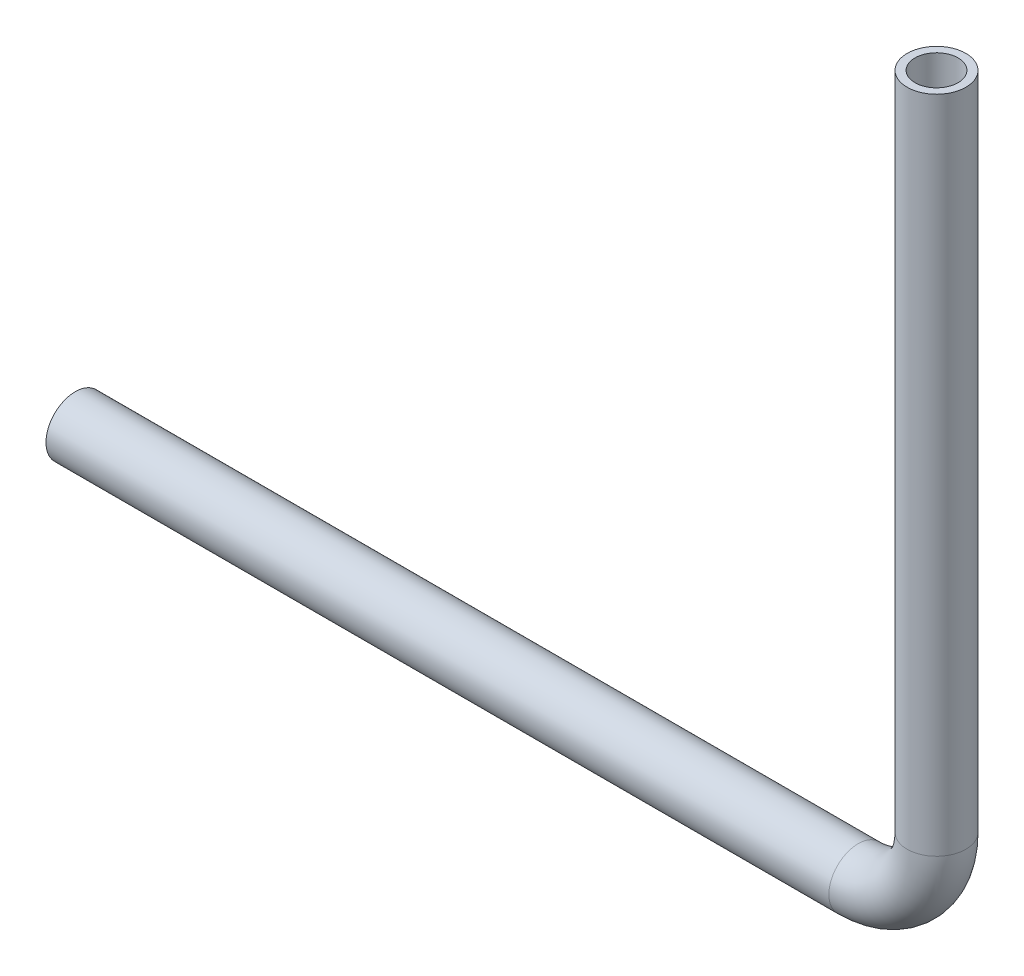
from build123d import *

# Parameters (mm, degrees)
SKETCH6_R   = 7.5
SKETCH6_R_2 = 5.5


with BuildPart() as part:
    # Sweep1: sweep along a path in Sketch5
    with BuildLine(Plane.XY) as sweep1_path:
        Line((-136.721786748, 77.052875388), (63.278213252, 77.052875388))
        ThreePointArc((63.278213252, 77.052875388), (77.420348876, 82.910739764), (83.278213252, 97.052875388))
        Line((83.278213252, 97.052875388), (83.278213252, 265.636948852))
    # Sketch6 → Sweep1 (sweep)
    with BuildSketch(Plane(origin=(-136.721786748, 0, 0), x_dir=(0, 0, -1), z_dir=(1, 0, 0))):
        with Locations((0, 77.052875388)):
            Circle(SKETCH6_R)
        with Locations((0, 77.052875388)):
            Circle(SKETCH6_R_2, mode=Mode.SUBTRACT)
    sweep(path=sweep1_path.line)


solid = part.part
